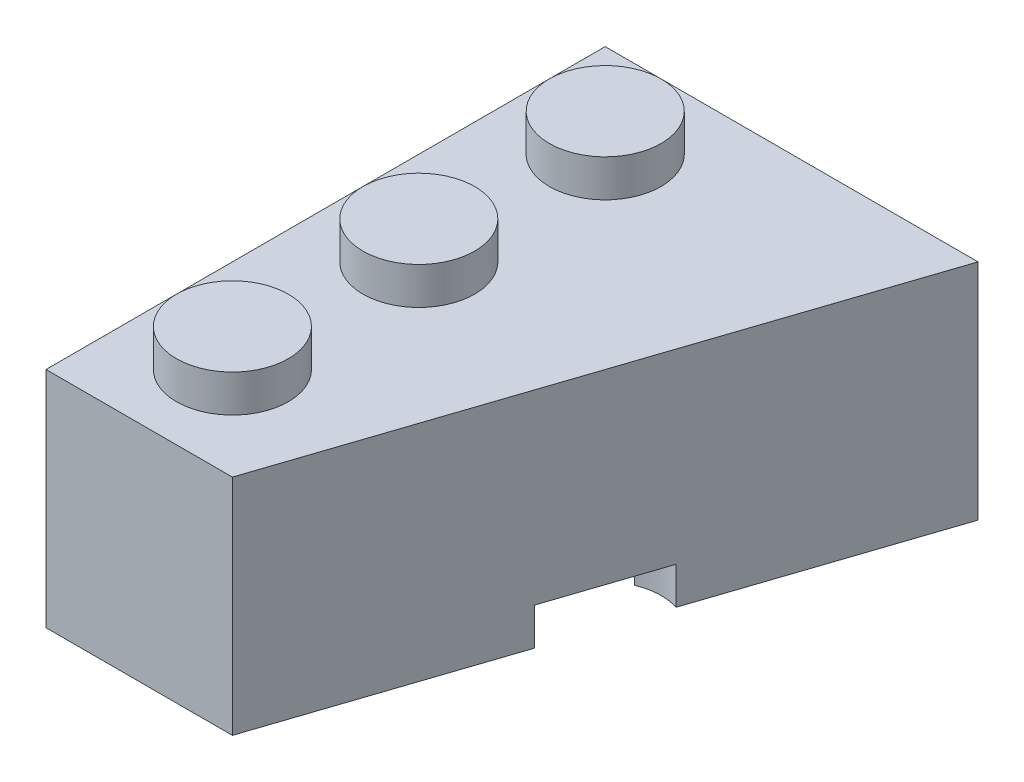
from build123d import *

# Parameters (mm, degrees)
BOSS_EXTRUDE1_DEPTH = 9.6
SKETCH2_R           = 2.4
BOSS_EXTRUDE2_DEPTH = 1.6
LPATTERN1_COUNT     = 3
LPATTERN1_PITCH     = 8
SHELL1_T            = -1.6
SKETCH3_R           = 2.4
CUT_EXTRUDE1_DEPTH  = 1.6


with BuildPart() as part:
    # Sketch1 → Boss-Extrude1 (new body)
    with BuildSketch(Plane(origin=(0, 0, 0), x_dir=(1, 0, 0), z_dir=(0, 1, 0))):
        Polygon((0, 0), (8, 0), (16, 24), (0, 24), align=None)
    extrude(amount=BOSS_EXTRUDE1_DEPTH)

    # Sketch2 → Boss-Extrude2 (add)
    with BuildSketch(Plane(origin=(0, 9.6, 0), x_dir=(1, 0, 0), z_dir=(0, 1, 0))):
        with Locations(Location((4, 4, 0), (0, 0, 270))):
            Circle(SKETCH2_R)
    boss_extrude2 = extrude(amount=BOSS_EXTRUDE2_DEPTH)

    # LPattern1: Boss-Extrude2 ×3
    with Locations(*[(0, 0, -i * LPATTERN1_PITCH) for i in range(1, LPATTERN1_COUNT)]):
        add(boss_extrude2)

    # Shell1
    shell1_openings = [part.faces().sort_by_distance(p)[0] for p in [
        (6.222222222, 0, -13.333333333),
    ]]
    offset(amount=SHELL1_T, openings=shell1_openings, kind=Kind.INTERSECTION)

    # Sketch3 → Cut-Extrude1 (cut)
    with BuildSketch(Plane.XZ):
        with Locations((12, -20)):
            Circle(SKETCH3_R)
        with Locations((12, -12)):
            Circle(SKETCH3_R)
    extrude(amount=-CUT_EXTRUDE1_DEPTH, mode=Mode.SUBTRACT)


solid = part.part
